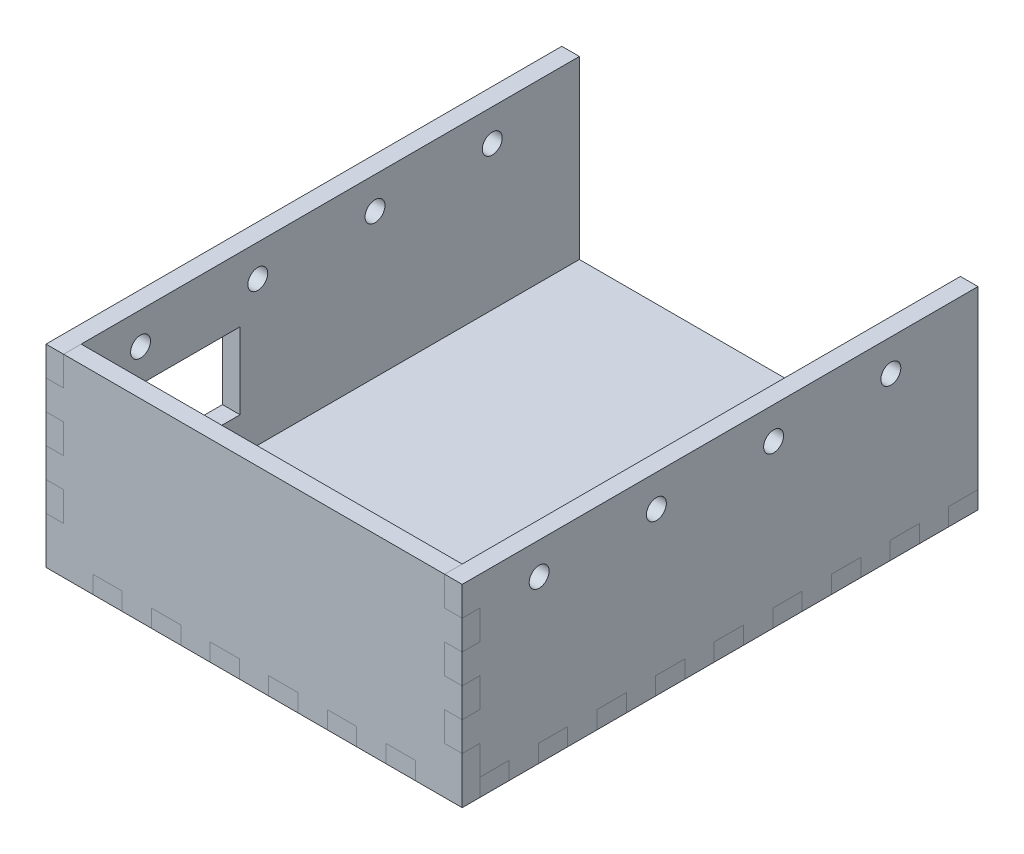
from build123d import *

# Parameters (mm, degrees)
BOSS_EXTRUDE1_DEPTH = 3
BOSS_EXTRUDE2_DEPTH = 3
BOSS_EXTRUDE3_DEPTH = 3
SKETCH6_R           = 1.7
CUT_EXTRUDE1_DEPTH  = 76
SKETCH7_W           = 21
SKETCH7_H           = 13
CUT_EXTRUDE2_DEPTH  = 6


with BuildPart() as part:
    # Sketch1 → Boss-Extrude1 (new body)
    with BuildSketch(Plane(origin=(0, 0, 0), x_dir=(1, 0, 0), z_dir=(0, 1, 0))):
        Polygon((65, -5), (68, -5), (68, -10), (65, -10), (65, -15), (68, -15), (68, -20), (65, -20), (65, -25), (68, -25), (68, -30), (65, -30), (65, -35), (68, -35), (68, -40), (65, -40), (65, -45), (68, -45), (68, -50), (65, -50), (65, -55), (68, -55), (68, -60), (65, -60), (65, -65), (68, -65), (68, -70), (65, -70), (65, -75), (68, -75), (68, -80), (65, -80), (65, -85), (68, -85), (68, -90), (65, -90), (60, -90), (60, -93), (55, -93), (55, -90), (50, -90), (50, -93), (45, -93), (45, -90), (40, -90), (40, -93), (35, -93), (35, -90), (30, -90), (30, -93), (25, -93), (25, -90), (20, -90), (20, -93), (15, -93), (15, -90), (10, -90), (10, -93), (5, -93), (5, -90), (0, -90), (-3, -90), (-3, -85), (0, -85), (0, -80), (-3, -80), (-3, -75), (0, -75), (0, -70), (-3, -70), (-3, -65), (0, -65), (0, -60), (-3, -60), (-3, -55), (0, -55), (0, -50), (-3, -50), (-3, -45), (0, -45), (0, -40), (-3, -40), (-3, -35), (0, -35), (0, -30), (-3, -30), (-3, -25), (0, -25), (0, -20), (-3, -20), (-3, -15), (0, -15), (0, -10), (-3, -10), (-3, -5), align=None)
    extrude(amount=BOSS_EXTRUDE1_DEPTH)


with BuildPart() as body_2:
    # Sketch3 → Boss-Extrude2 (new body)
    with BuildSketch(Plane.ZY):
        Polygon((10, 0), (15, 0), (15, 3), (20, 3), (20, 0), (25, 0), (25, 3), (30, 3), (30, 0), (35, 0), (35, 3), (40, 3), (40, 0), (45, 0), (45, 3), (50, 3), (50, 0), (55, 0), (55, 3), (60, 3), (60, 0), (65, 0), (65, 3), (70, 3), (70, 0), (75, 0), (75, 3), (80, 3), (80, 0), (85, 0), (85, 3), (90, 3), (90, 8), (93, 8), (93, 13), (90, 13), (90, 18), (93, 18), (93, 23), (90, 23), (90, 28), (93, 28), (93, 33), (5, 33), (5, 3), (10, 3), align=None)
    extrude(amount=BOSS_EXTRUDE2_DEPTH)


with BuildPart() as body_3:
    # Mirror1: mirrored copy
    add(body_2.part.mirror(Plane.ZY.offset(-32.5)))


with BuildPart() as body_4:
    # Sketch5 → Boss-Extrude3 (new body)
    with BuildSketch(Plane.XY.offset(90)):
        Polygon((60, 0), (68, 0), (68, 8), (65, 8), (65, 13), (68, 13), (68, 18), (65, 18), (65, 23), (68, 23), (68, 28), (65, 28), (65, 33), (0, 33), (0, 28), (-3, 28), (-3, 23), (0, 23), (0, 18), (-3, 18), (-3, 13), (0, 13), (0, 8), (-3, 8), (-3, 3), (-3, 0), (0, 0), (5, 0), (5, 3), (10, 3), (10, 0), (15, 0), (15, 3), (20, 3), (20, 0), (25, 0), (25, 3), (30, 3), (30, 0), (35, 0), (35, 3), (40, 3), (40, 0), (45, 0), (45, 3), (50, 3), (50, 0), (55, 0), (55, 3), (60, 3), align=None)
    extrude(amount=BOSS_EXTRUDE3_DEPTH)


with BuildPart() as cut_extrude1_tool:
    # Sketch6 → Cut-Extrude1 (new body)
    with BuildSketch(Plane.ZY.offset(3)):
        with Locations((19.867689039, 27.564789871)):
            Circle(SKETCH6_R)
        with Locations((39.867689039, 27.564789871)):
            Circle(SKETCH6_R)
        with Locations((59.867689039, 27.564789871)):
            Circle(SKETCH6_R)
        with Locations((79.867689039, 27.564789871)):
            Circle(SKETCH6_R)
    extrude(amount=-CUT_EXTRUDE1_DEPTH)


with BuildPart() as body_2_1:
    add(body_2.part)

    # Cut-Extrude1: cut by cut_extrude1_tool
    add(cut_extrude1_tool.part, mode=Mode.SUBTRACT)

    # Sketch7 → Cut-Extrude2 (cut)
    with BuildSketch(Plane.ZY.offset(3)):
        with Locations((73.395519307, 15.505784004)):
            Rectangle(SKETCH7_W, SKETCH7_H)
    extrude(amount=-CUT_EXTRUDE2_DEPTH, mode=Mode.SUBTRACT)


with BuildPart() as body_3_1:
    add(body_3.part)

    # Cut-Extrude1: cut by cut_extrude1_tool
    add(cut_extrude1_tool.part, mode=Mode.SUBTRACT)


solid = Compound([part.part, body_4.part, body_2_1.part, body_3_1.part])
